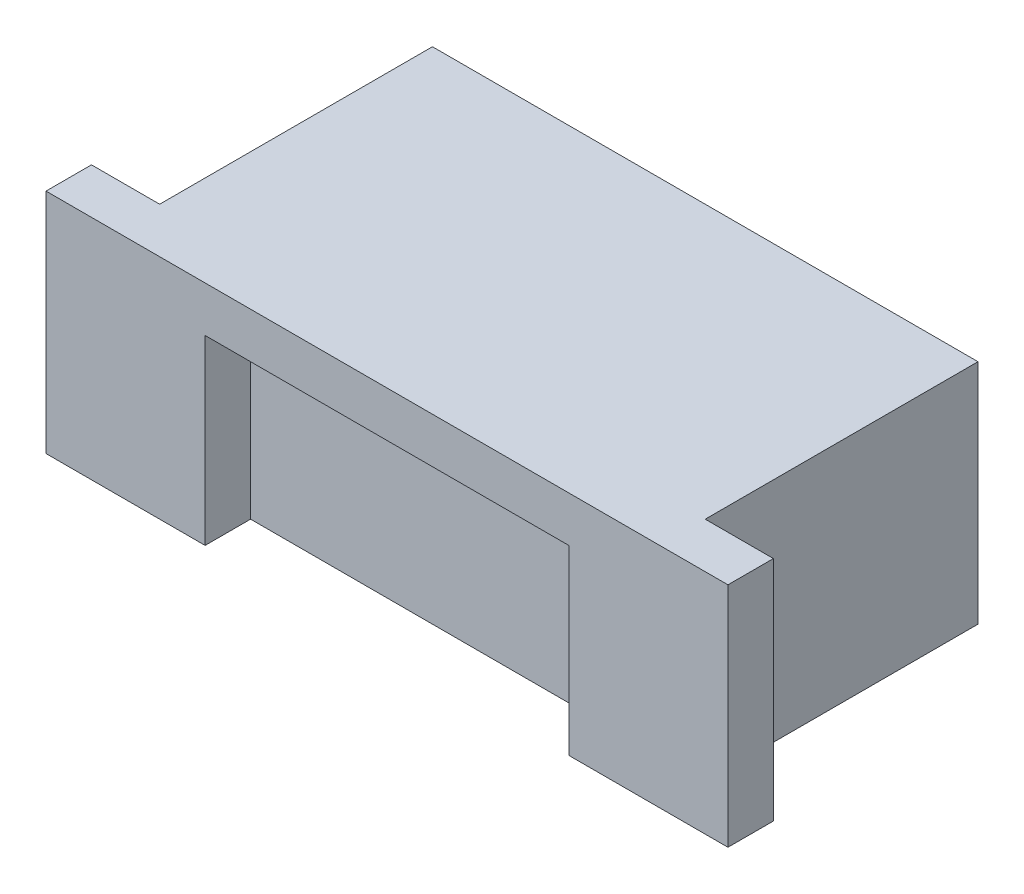
from build123d import *

# Parameters (mm, degrees)
BOSS_EXTRUDE1_DEPTH = 2.5
SKETCH2_W           = 4
SKETCH2_H           = 2
CUT_EXTRUDE1_DEPTH  = 0.5


with BuildPart() as part:
    # Sketch1 → Boss-Extrude1 (new body)
    with BuildSketch(Plane(origin=(0, 0, 0), x_dir=(1, 0, 0), z_dir=(0, 1, 0))):
        Polygon((0, 0), (7.5, 0), (7.5, 0.5), (6.75, 0.5), (6.75, 3.5), (0.75, 3.5), (0.75, 0.5), (0, 0.5), align=None)
    extrude(amount=BOSS_EXTRUDE1_DEPTH)

    # Sketch2 → Cut-Extrude1 (cut)
    with BuildSketch(Plane.XY):
        with Locations((3.75, 1)):
            Rectangle(SKETCH2_W, SKETCH2_H)
    extrude(amount=-CUT_EXTRUDE1_DEPTH, mode=Mode.SUBTRACT)


solid = part.part
